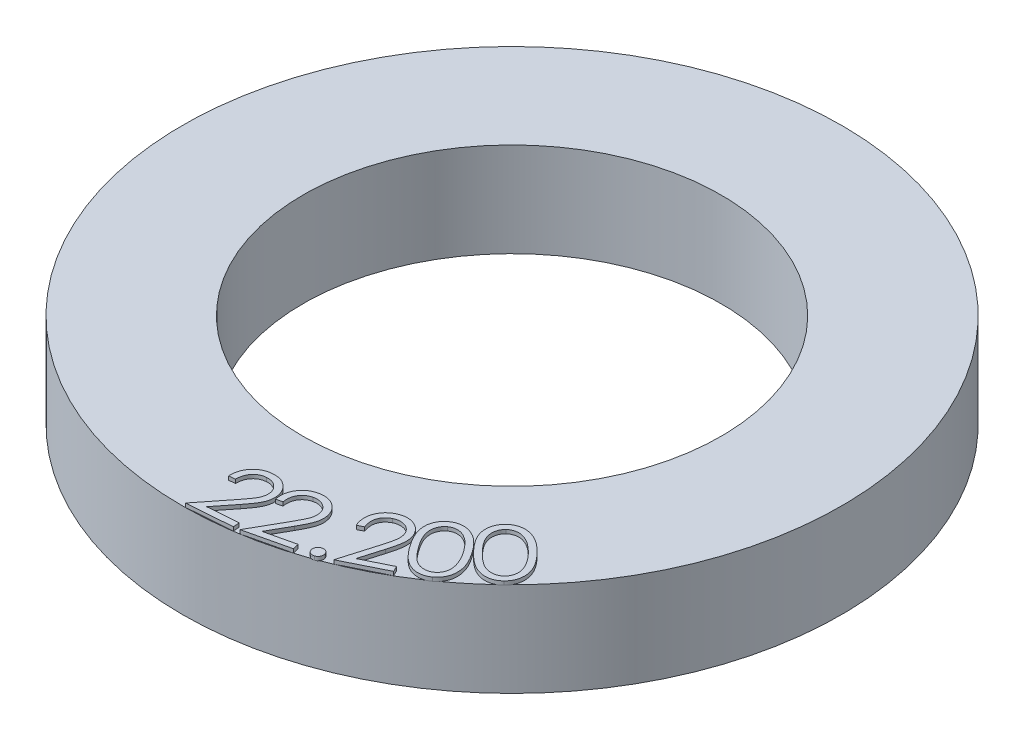
from build123d import *

# Parameters (mm, degrees)
SKETCH1_R           = 17.5
SKETCH1_R_2         = 11.1
BOSS_EXTRUDE1_DEPTH = 5
BOSS_EXTRUDE9_DEPTH = 0.2


with BuildPart() as part:
    # Sketch1 → Boss-Extrude1 (new body)
    with BuildSketch(Plane(origin=(0, 0, 0), x_dir=(1, 0, 0), z_dir=(0, 1, 0))):
        Circle(SKETCH1_R)
        Circle(SKETCH1_R_2, mode=Mode.SUBTRACT)
    extrude(amount=BOSS_EXTRUDE1_DEPTH)

    # Sketch9 → Boss-Extrude9 (add)
    # profile 1 of 6: a face of its own
    with BuildSketch(Plane(origin=(0, 5, 0), x_dir=(1, 0, 0), z_dir=(0, 1, 0))):
        with BuildLine():
            Line((0.377203526, -15.06640625), (0.043469551, -15.092347756))
            add(Edge.make_bspline(
                [(0.043469551, -15.092347756), (0.042203297, -15.050032699), (0.039723419, -14.96716131), (0.049638285, -14.844981972), (0.067688405, -14.727624407), (0.098455755, -14.61556583), (0.138504263, -14.508522308), (0.188279293, -14.405930448), (0.249943807, -14.309195828), (0.320224245, -14.217586795), (0.399116148, -14.133937543), (0.484222111, -14.059456033), (0.574336923, -13.993992114), (0.671078969, -13.940092371), (0.773224869, -13.895612995), (0.881084602, -13.861423192), (0.994390789, -13.836174987), (1.072362547, -13.828578994), (1.111979167, -13.824719551)],
                knots=[0, 0, 0, 0, 1.099165856, 2.152647473, 3.179901334, 4.180092559, 5.165857059, 6.14623908, 7.136854445, 8.141313093, 9.142222958, 10.119044223, 11.076246807, 12.030555843, 12.990566437, 13.966122304, 14.966608418, 16, 16, 16, 16], degree=3))
            add(Edge.make_bspline(
                [(1.111979167, -13.824719551), (1.151232363, -13.822614291), (1.227892409, -13.818502795), (1.341072803, -13.824300473), (1.449209712, -13.840047194), (1.552456645, -13.867170925), (1.650809554, -13.903432336), (1.744251767, -13.950064736), (1.832189716, -14.007297288), (1.914237577, -14.07371881), (1.989801801, -14.146775331), (2.056191283, -14.225750107), (2.115236363, -14.307662186), (2.163673815, -14.394967734), (2.203994369, -14.485852699), (2.23381166, -14.581483532), (2.256306856, -14.680631266), (2.263224051, -14.74868976), (2.266726763, -14.783153045)],
                knots=[0, 0, 0, 0, 1.125255338, 2.197582177, 3.23984224, 4.249678898, 5.249348258, 6.237204937, 7.234226399, 8.248247252, 9.256507582, 10.239567543, 11.199778339, 12.143800945, 13.093950023, 14.042329097, 15.008679649, 16, 16, 16, 16], degree=3))
            add(Edge.make_bspline(
                [(2.266726763, -14.783153045), (2.268653871, -14.83201524), (2.272472697, -14.928842275), (2.256591946, -15.073272294), (2.221554197, -15.213909987), (2.177756368, -15.329043673), (2.13210079, -15.422970742), (2.088829613, -15.499650514), (2.039151976, -15.583479859), (1.980752569, -15.67318269), (1.913642882, -15.76882397), (1.840613729, -15.872212721), (1.757921696, -15.980725817), (1.700055339, -16.055042687), (1.670072115, -16.093549679)],
                knots=[0, 0, 0, 0, 1.190284496, 2.358709392, 3.525773572, 4.713480732, 5.352743619, 6.06901355, 6.858115264, 7.726847504, 8.676217017, 9.704931629, 10.810819393, 12, 12, 12, 12], degree=3))
            Line((1.670072115, -16.093549679), (0.875701122, -17.094751603))
            Line((0.875701122, -17.094751603), (2.482672276, -16.971354167))
            Line((2.482672276, -16.971354167), (2.508613782, -17.307191506))
            Line((2.508613782, -17.307191506), (0.14443109, -17.488782051))
            Line((0.14443109, -17.488782051), (1.363681891, -15.949819712))
            add(Edge.make_bspline(
                [(1.363681891, -15.949819712), (1.393527022, -15.912554926), (1.450782044, -15.841066007), (1.530584566, -15.73612355), (1.602999147, -15.639675593), (1.666852925, -15.550639363), (1.722438282, -15.469396851), (1.76961629, -15.395481899), (1.809021619, -15.329602995), (1.849329165, -15.251857602), (1.888211722, -15.159145837), (1.917541309, -15.046099013), (1.933704742, -14.93175562), (1.93042781, -14.855174346), (1.928786058, -14.816806891)],
                knots=[0, 0, 0, 0, 1.323859622, 2.539697786, 3.655679983, 4.668207506, 5.577749991, 6.384956845, 7.099630202, 7.705429782, 8.812646299, 9.878423536, 10.93708365, 12, 12, 12, 12], degree=3))
            add(Edge.make_bspline(
                [(1.928786058, -14.816806891), (1.92620974, -14.792668697), (1.921140936, -14.745177743), (1.905685163, -14.675960851), (1.882668381, -14.610204079), (1.854314913, -14.54686504), (1.818130268, -14.487171166), (1.775716227, -14.430480301), (1.726271651, -14.377301953), (1.671340099, -14.327125852), (1.611934069, -14.281949704), (1.548780398, -14.24375581), (1.483443961, -14.212316408), (1.415907726, -14.186368957), (1.345139571, -14.169292508), (1.271999298, -14.157876025), (1.196114655, -14.153502913), (1.144924611, -14.156323447), (1.118990385, -14.157752404)],
                knots=[0, 0, 0, 0, 1.002985613, 1.973335034, 2.923515741, 3.878986154, 4.836651989, 5.802759845, 6.800988188, 7.833639541, 8.87511098, 9.880838076, 10.878972912, 11.86950441, 12.865345595, 13.881918786, 14.926924211, 16, 16, 16, 16], degree=3))
            add(Edge.make_bspline(
                [(1.118990385, -14.157752404), (1.091811261, -14.160540619), (1.038491161, -14.166010548), (0.960749235, -14.182373159), (0.886899306, -14.205342141), (0.817246391, -14.235736869), (0.751710741, -14.272344942), (0.690146343, -14.315288584), (0.633132276, -14.365692478), (0.580060436, -14.422065975), (0.532383632, -14.484564259), (0.490634628, -14.552362028), (0.455698611, -14.625546395), (0.426899376, -14.703718722), (0.404472482, -14.787020099), (0.388336351, -14.875402791), (0.379467781, -14.969236984), (0.377971809, -15.033435801), (0.377203526, -15.06640625)],
                knots=[0, 0, 0, 0, 1.003856858, 1.969369873, 2.914991585, 3.842326504, 4.757764574, 5.67065914, 6.596081697, 7.550367434, 8.512664105, 9.480773, 10.472199548, 11.488843046, 12.539268398, 13.639696742, 14.787824085, 16, 16, 16, 16], degree=3))
        make_face()
    # profile 2 of 6: a face of its own
    with BuildSketch(Plane(origin=(0, 5, 0), x_dir=(1, 0, 0), z_dir=(0, 1, 0))):
        with BuildLine():
            Line((2.680077799, -14.84254585), (2.355458408, -14.918267004))
            add(Edge.make_bspline(
                [(2.355458408, -14.918267004), (2.347994142, -14.876767046), (2.333387531, -14.795556953), (2.323472579, -14.673990721), (2.324976016, -14.555728299), (2.336513827, -14.440605451), (2.359783356, -14.328975701), (2.394590343, -14.221092867), (2.439601661, -14.116379831), (2.494569659, -14.015576781), (2.559832485, -13.921863348), (2.631188548, -13.834656401), (2.710921768, -13.757361702), (2.797573287, -13.688946733), (2.891342116, -13.629703088), (2.992353062, -13.580084855), (3.099856127, -13.537971321), (3.175300136, -13.518303724), (3.213631485, -13.508311075)],
                knots=[0, 0, 0, 0, 1.100238416, 2.153025381, 3.178012026, 4.183884262, 5.168591255, 6.148695239, 7.138002634, 8.140019377, 9.140121407, 10.114951831, 11.077023251, 12.032670763, 12.99234068, 13.966349905, 14.966749606, 16, 16, 16, 16], degree=3))
            add(Edge.make_bspline(
                [(3.213631485, -13.508311075), (3.251843088, -13.50036415), (3.32664053, -13.484808413), (3.438897548, -13.473770246), (3.547813259, -13.472847982), (3.653615731, -13.482442125), (3.755983303, -13.503477882), (3.854414489, -13.536291351), (3.950096274, -13.578421826), (4.040814221, -13.631584861), (4.126003653, -13.692404589), (4.204208412, -13.758970295), (4.274030899, -13.831494589), (4.335160407, -13.90960072), (4.388361962, -13.993145467), (4.432982751, -14.082231672), (4.470178835, -14.176708828), (4.487307474, -14.242643219), (4.495983248, -14.27603944)],
                knots=[0, 0, 0, 0, 1.121990491, 2.196244399, 3.238232453, 4.250969426, 5.246356061, 6.236987075, 7.230101134, 8.248200839, 9.255501669, 10.237657177, 11.19803806, 12.146105858, 13.086011545, 14.042029985, 15.008274769, 16, 16, 16, 16], degree=3))
            add(Edge.make_bspline(
                [(4.495983248, -14.27603944), (4.505415824, -14.323774993), (4.524110077, -14.41838123), (4.529985585, -14.56283772), (4.516844757, -14.706380405), (4.49162199, -14.826395359), (4.460506924, -14.925374116), (4.431085731, -15.007919873), (4.393488718, -15.097141834), (4.349829317, -15.194418504), (4.299347185, -15.299042154), (4.242538162, -15.411720311), (4.177915647, -15.531101044), (4.131979942, -15.612908193), (4.108262895, -15.655146011)],
                knots=[0, 0, 0, 0, 1.190223456, 2.358882579, 3.52524119, 4.712819824, 5.35365978, 6.065105631, 6.857984567, 7.723828008, 8.67607557, 9.702436758, 10.813745988, 12, 12, 12, 12], degree=3))
            Line((4.108262895, -15.655146011), (3.479356645, -16.761516203))
            Line((3.479356645, -16.761516203), (5.041456004, -16.394829504))
            Line((5.041456004, -16.394829504), (5.11787828, -16.721552261))
            Line((5.11787828, -16.721552261), (2.819601036, -17.260714921))
            Line((2.819601036, -17.260714921), (3.785045748, -15.56119569))
            add(Edge.make_bspline(
                [(3.785045748, -15.56119569), (3.808529371, -15.519892567), (3.8536226, -15.440582352), (3.91665988, -15.325551236), (3.973290102, -15.219474376), (4.021957514, -15.121779814), (4.064311127, -15.032979861), (4.100364837, -14.953571722), (4.128654637, -14.882434307), (4.156784414, -14.800101176), (4.179688984, -14.702577351), (4.192972915, -14.587024863), (4.189968714, -14.471889792), (4.175230987, -14.396958355), (4.167858248, -14.359472934)],
                knots=[0, 0, 0, 0, 1.322508168, 2.539478858, 3.65113322, 4.669382137, 5.577246142, 6.389686428, 7.096378664, 7.707362647, 8.810322298, 9.877140803, 10.938012216, 12, 12, 12, 12], degree=3))
            add(Edge.make_bspline(
                [(4.167858248, -14.359472934), (4.161829404, -14.336171476), (4.149935411, -14.290201239), (4.123387221, -14.224893717), (4.091995869, -14.16328915), (4.053584185, -14.106135055), (4.009399893, -14.052600205), (3.95860095, -14.003544562), (3.901957352, -13.958350343), (3.840235373, -13.917568468), (3.775029978, -13.881814057), (3.707248163, -13.853637752), (3.637912338, -13.832678602), (3.56741324, -13.817301491), (3.494890393, -13.811664684), (3.421495235, -13.811468351), (3.346244991, -13.818247864), (3.296509601, -13.82889709), (3.271123472, -13.834332709)],
                knots=[0, 0, 0, 0, 0.998805992, 1.97049261, 2.921394182, 3.866479787, 4.824835265, 5.799717433, 6.794315519, 7.830951375, 8.869177059, 9.878822869, 10.873799922, 11.875291578, 12.869368348, 13.888722291, 14.922353531, 16, 16, 16, 16], degree=3))
            add(Edge.make_bspline(
                [(3.271123472, -13.834332709), (3.244792519, -13.841064204), (3.193002937, -13.854304184), (3.119061623, -13.882705923), (3.050115946, -13.91714881), (2.986034959, -13.957311139), (2.926579811, -14.002814596), (2.87305675, -14.05555418), (2.823928987, -14.113545846), (2.780414933, -14.177443519), (2.743380272, -14.246402199), (2.712244756, -14.319205359), (2.689061885, -14.396615139), (2.673136557, -14.477873433), (2.664009273, -14.563501926), (2.662180891, -14.653056839), (2.666949138, -14.746824786), (2.675629023, -14.810109822), (2.680077799, -14.84254585)],
                knots=[0, 0, 0, 0, 1.001857296, 1.97052376, 2.915105733, 3.840812044, 4.756468097, 5.670946457, 6.606992161, 7.556283339, 8.516782409, 9.490308786, 10.47212129, 11.491627338, 12.540773751, 13.644567144, 14.792749573, 16, 16, 16, 16], degree=3))
        make_face()
    # profile 3 of 6: a face of its own
    with BuildSketch(Plane(origin=(0, 5, 0), x_dir=(1, 0, 0), z_dir=(0, 1, 0))):
        with BuildLine():
            add(Edge.make_bspline(
                [(5.812610444, -15.938128556), (5.831374417, -15.932374898), (5.868100028, -15.921113607), (5.925587729, -15.918820778), (5.982023209, -15.927326543), (6.036365652, -15.947186897), (6.086750753, -15.976062519), (6.129683552, -16.014781695), (6.164195697, -16.061839206), (6.179302393, -16.097844445), (6.187009483, -16.116213491)],
                knots=[0, 0, 0, 0, 1.018533362, 1.993514881, 2.966138152, 3.9748784, 4.989476654, 5.972026843, 6.965374611, 8, 8, 8, 8], degree=3))
            add(Edge.make_bspline(
                [(6.187009483, -16.116213491), (6.192680674, -16.134982532), (6.203852009, -16.171954526), (6.207259114, -16.229869607), (6.198423544, -16.286997519), (6.178873974, -16.341926891), (6.149719297, -16.392227049), (6.111823907, -16.435344643), (6.065578658, -16.469979456), (6.029886494, -16.484584723), (6.011729034, -16.492014773)],
                knots=[0, 0, 0, 0, 1.018247088, 2.005783202, 2.990165439, 4.010083513, 5.024396598, 5.998572224, 6.981825626, 8, 8, 8, 8], degree=3))
            add(Edge.make_bspline(
                [(6.011729034, -16.492014773), (5.992964701, -16.497770106), (5.956238387, -16.509034678), (5.898755786, -16.511303732), (5.842003107, -16.502843983), (5.787364663, -16.482393394), (5.737095106, -16.452595757), (5.694096527, -16.414271405), (5.660232144, -16.367416245), (5.645083379, -16.332037335), (5.637329996, -16.313929838)],
                knots=[0, 0, 0, 0, 1.019327242, 1.995068695, 2.968450063, 3.99358383, 5.015165017, 5.99848104, 6.975590248, 8, 8, 8, 8], degree=3))
            add(Edge.make_bspline(
                [(5.637329996, -16.313929838), (5.63125142, -16.294941947), (5.619366426, -16.257816312), (5.617673921, -16.1996281), (5.624612676, -16.142442807), (5.645777227, -16.087974496), (5.675371175, -16.038150206), (5.712952105, -15.994657098), (5.759716127, -15.961248414), (5.794765915, -15.945928316), (5.812610444, -15.938128556)],
                knots=[0, 0, 0, 0, 1.033330105, 2.02039479, 3.003248301, 4.016090021, 5.036799157, 6.01117572, 6.98745084, 8, 8, 8, 8], degree=3))
        make_face()
    # profile 4 of 6: a face of its own
    with BuildSketch(Plane(origin=(0, 5, 0), x_dir=(1, 0, 0), z_dir=(0, 1, 0))):
        with BuildLine():
            Line((6.001967488, -13.825784929), (5.702588481, -13.97442275))
            add(Edge.make_bspline(
                [(5.702588481, -13.97442275), (5.685820824, -13.935647981), (5.652971266, -13.859684236), (5.615366393, -13.743154614), (5.590497806, -13.627273302), (5.575039188, -13.512168107), (5.572189463, -13.397675061), (5.581852614, -13.28411572), (5.601054551, -13.171207906), (5.633145609, -13.060466763), (5.673495528, -12.952927229), (5.725335534, -12.852311195), (5.785096594, -12.758589391), (5.853397414, -12.671412601), (5.931763681, -12.592336106), (6.018296114, -12.519614104), (6.11423699, -12.454603032), (6.183416212, -12.418216443), (6.218614122, -12.399703199)],
                knots=[0, 0, 0, 0, 1.098216958, 2.151519521, 3.177948553, 4.176818265, 5.167798255, 6.149509108, 7.136735762, 8.141063819, 9.143385336, 10.119208589, 11.078539156, 12.030603135, 12.993316239, 13.9683821, 14.966326847, 16, 16, 16, 16], degree=3))
            add(Edge.make_bspline(
                [(6.218614122, -12.399703199), (6.254108919, -12.383194162), (6.32393023, -12.35071947), (6.43114222, -12.313475674), (6.537857316, -12.288262433), (6.643215578, -12.2728673), (6.748120394, -12.270285627), (6.852018267, -12.278626884), (6.955213384, -12.298455178), (7.056185903, -12.329531901), (7.153670355, -12.368980935), (7.245165062, -12.416808689), (7.329730409, -12.47194654), (7.408224671, -12.533336388), (7.478366063, -12.603917009), (7.543252607, -12.679970693), (7.600620697, -12.764273206), (7.632638787, -12.82472532), (7.648902584, -12.855432365)],
                knots=[0, 0, 0, 0, 1.120251964, 2.203631692, 3.242265402, 4.255679864, 5.246286426, 6.239781059, 7.234446576, 8.24830269, 9.25968307, 10.241300852, 11.19891005, 12.146674702, 13.088183727, 14.042538329, 15.005694608, 16, 16, 16, 16], degree=3))
            add(Edge.make_bspline(
                [(7.648902584, -12.855432365), (7.668992821, -12.899855098), (7.708920725, -12.988142087), (7.748067721, -13.128098782), (7.768240766, -13.271648984), (7.770631342, -13.394750405), (7.762858058, -13.498559304), (7.752092962, -13.585785611), (7.736493913, -13.68187063), (7.716013743, -13.787055879), (7.69069926, -13.901123287), (7.660545135, -14.024148371), (7.624504342, -14.155549315), (7.598518339, -14.246018432), (7.5851005, -14.292732045)],
                knots=[0, 0, 0, 0, 1.187463185, 2.359997786, 3.528509958, 4.713988962, 5.35383184, 6.065580174, 6.856257793, 7.726840367, 8.678057719, 9.704934027, 10.814945631, 12, 12, 12, 12], degree=3))
            Line((7.5851005, -14.292732045), (7.224723898, -15.518994064))
            Line((7.224723898, -15.518994064), (8.667632552, -14.80244759))
            Line((8.667632552, -14.80244759), (8.816971494, -15.103929961))
            Line((8.816971494, -15.103929961), (6.693974699, -16.157716019))
            Line((6.693974699, -16.157716019), (7.247860917, -14.275204))
            add(Edge.make_bspline(
                [(7.247860917, -14.275204), (7.261216532, -14.229408296), (7.286876156, -14.141422794), (7.323272157, -14.014573528), (7.352928105, -13.897448573), (7.379238865, -13.79101086), (7.400466112, -13.694725735), (7.416680923, -13.608691772), (7.428254495, -13.532710147), (7.436784056, -13.445777823), (7.437679595, -13.345309727), (7.423574568, -13.229573332), (7.394631036, -13.117883998), (7.363161271, -13.048093644), (7.347420212, -13.013184769)],
                knots=[0, 0, 0, 0, 1.323043671, 2.541912292, 3.659661485, 4.673647795, 5.582680748, 6.39374756, 7.101410763, 7.71347622, 8.815383168, 9.879822486, 10.939495118, 12, 12, 12, 12], degree=3))
            add(Edge.make_bspline(
                [(7.347420212, -13.013184769), (7.336199736, -12.991870827), (7.313943969, -12.94959471), (7.27280693, -12.89181288), (7.227957876, -12.838314629), (7.176854253, -12.791398988), (7.121438056, -12.749037476), (7.060750134, -12.71243175), (6.995033612, -12.681704385), (6.925468021, -12.655795048), (6.85337338, -12.636552867), (6.780689458, -12.62340517), (6.708063405, -12.618801324), (6.635686798, -12.620547507), (6.563642767, -12.630808967), (6.491726636, -12.647573982), (6.419941269, -12.672258366), (6.373387767, -12.693761037), (6.349723898, -12.704691179)],
                knots=[0, 0, 0, 0, 0.994758845, 1.973100073, 2.925721505, 3.875988117, 4.834471289, 5.80548545, 6.799540207, 7.829750797, 8.870374877, 9.880638117, 10.878114759, 11.873717852, 12.868476697, 13.880909124, 14.922833172, 16, 16, 16, 16], degree=3))
            add(Edge.make_bspline(
                [(6.349723898, -12.704691179), (6.325650167, -12.717362623), (6.278165227, -12.742356785), (6.212118308, -12.786429715), (6.153131579, -12.836220645), (6.098864702, -12.889172981), (6.053262642, -12.948802926), (6.011531189, -13.011471236), (5.977611366, -13.079731547), (5.949408591, -13.151936052), (5.92839382, -13.227779199), (5.914822451, -13.306460902), (5.910509511, -13.387530291), (5.912202467, -13.470857467), (5.923178633, -13.556459032), (5.94169448, -13.644521266), (5.967463926, -13.735074122), (5.990292997, -13.795092375), (6.001967488, -13.825784929)],
                knots=[0, 0, 0, 0, 0.999474696, 1.971443358, 2.910637607, 3.833827542, 4.751406304, 5.663865081, 6.597307257, 7.546386594, 8.509165209, 9.48492176, 10.474530171, 11.488406048, 12.544202824, 13.640856743, 14.793564798, 16, 16, 16, 16], degree=3))
        make_face()
    # profile 5 of 6: a face of its own
    with BuildSketch(Plane(origin=(0, 5, 0), x_dir=(1, 0, 0), z_dir=(0, 1, 0))):
        with BuildLine():
            add(Edge.make_bspline(
                [(8.094622628, -13.519240223), (8.062802559, -13.473618044), (8.000905639, -13.384873031), (7.915172489, -13.252508419), (7.839826708, -13.124911808), (7.772418464, -13.003590397), (7.715531182, -12.886947474), (7.667790368, -12.775573225), (7.628608309, -12.669765668), (7.599775725, -12.568374636), (7.57829551, -12.470964938), (7.564758618, -12.376238395), (7.555557095, -12.284294604), (7.554709495, -12.194779161), (7.558280296, -12.107556209), (7.56976583, -12.022720596), (7.587145911, -11.940382527), (7.611262051, -11.861045683), (7.640449512, -11.784480464), (7.675936321, -11.711756768), (7.714835306, -11.641852914), (7.759909289, -11.576363682), (7.810818614, -11.515563075), (7.86566587, -11.457507344), (7.925820181, -11.403394691), (7.96954674, -11.3711224), (7.991557724, -11.354877242)],
                knots=[0, 0, 0, 0, 1.642969674, 3.19593159, 4.656913794, 6.01942512, 7.294540572, 8.488352722, 9.597764224, 10.624727227, 11.599650019, 12.541783054, 13.449916964, 14.326759598, 15.183784796, 16.026369362, 16.852301942, 17.666934368, 18.473335003, 19.269954597, 20.055155662, 20.834508302, 21.614105503, 22.395381983, 23.192270741, 24, 24, 24, 24], degree=3))
            add(Edge.make_bspline(
                [(7.991557724, -11.354877242), (8.014728533, -11.339369003), (8.060599513, -11.308667524), (8.132399536, -11.268508388), (8.206244921, -11.234711547), (8.282223955, -11.207274971), (8.360094953, -11.18622085), (8.439854178, -11.171628727), (8.521136268, -11.162312696), (8.604110397, -11.159724321), (8.688578721, -11.162812956), (8.773819287, -11.174536389), (8.859848673, -11.192041023), (8.946298698, -11.216384108), (9.032693031, -11.249590455), (9.120586474, -11.287478045), (9.207995817, -11.334602958), (9.297025092, -11.387017274), (9.386746062, -11.44853229), (9.47668636, -11.520010056), (9.567394573, -11.601350717), (9.659297285, -11.691511762), (9.750755999, -11.792501066), (9.844512668, -11.901837519), (9.938055541, -12.021739437), (9.999130712, -12.106053576), (10.030419903, -12.149248236)],
                knots=[0, 0, 0, 0, 0.81737431, 1.618146333, 2.409359726, 3.196287572, 3.98428899, 4.771962527, 5.571913005, 6.381057778, 7.204158073, 8.047410857, 8.900877879, 9.777286907, 10.677253619, 11.613163999, 12.581895576, 13.586798653, 14.641794363, 15.768831792, 16.953190825, 18.213177769, 19.542243662, 20.947154321, 22.436008085, 24, 24, 24, 24], degree=3))
            add(Edge.make_bspline(
                [(10.030419903, -12.149248236), (10.060629559, -12.192752207), (10.119610721, -12.277689116), (10.200846542, -12.405103815), (10.273255924, -12.528865303), (10.337509449, -12.648219026), (10.391181621, -12.764540131), (10.43820567, -12.875909357), (10.475554519, -12.983869211), (10.50344957, -13.088309499), (10.524903819, -13.188904255), (10.538885623, -13.286836764), (10.546725682, -13.381904246), (10.548159793, -13.474420371), (10.543613126, -13.564233062), (10.531370439, -13.651605278), (10.513443822, -13.736309086), (10.488669914, -13.817775923), (10.458612044, -13.895915034), (10.422515108, -13.970199551), (10.382414939, -14.041346734), (10.335121159, -14.10739704), (10.284634864, -14.170670648), (10.227738255, -14.228915781), (10.166760539, -14.284258646), (10.122326211, -14.317244424), (10.099830961, -14.333943749)],
                knots=[0, 0, 0, 0, 1.554546396, 3.035087675, 4.433995603, 5.762808296, 7.011883954, 8.192851325, 9.310096466, 10.361795966, 11.364123238, 12.327475774, 13.263475298, 14.162233118, 15.041618427, 15.900208728, 16.749208619, 17.580395342, 18.396988438, 19.203929376, 20.002899753, 20.790808823, 21.585763951, 22.37656444, 23.178122201, 24, 24, 24, 24], degree=3))
            add(Edge.make_bspline(
                [(10.099830961, -14.333943749), (10.077145847, -14.349248799), (10.032078172, -14.379654774), (9.961226292, -14.41874203), (9.888830277, -14.451849879), (9.814590203, -14.47895069), (9.738195859, -14.498824708), (9.660247994, -14.513948211), (9.580492187, -14.52198494), (9.499406039, -14.52527875), (9.417145054, -14.520571171), (9.334005043, -14.510527935), (9.250744084, -14.491700989), (9.166953442, -14.467370492), (9.082999509, -14.435274057), (8.998560513, -14.396718689), (8.913206968, -14.351906005), (8.827985738, -14.298567689), (8.7409939, -14.237532695), (8.653670568, -14.165241162), (8.563416086, -14.08401014), (8.472884445, -13.99107976), (8.379836956, -13.888342291), (8.285786421, -13.774791097), (8.189344545, -13.65134699), (8.126795343, -13.564110867), (8.094622628, -13.519240223)],
                knots=[0, 0, 0, 0, 0.809272868, 1.607752371, 2.390541581, 3.162600615, 3.942452978, 4.723530369, 5.509215026, 6.311725545, 7.121736464, 7.944163862, 8.786349334, 9.643974587, 10.523613564, 11.442588803, 12.389010581, 13.373290706, 14.414956715, 15.530440954, 16.724797808, 18.00575213, 19.366615439, 20.824635093, 22.366724005, 24, 24, 24, 24], degree=3))
        make_face()
        with BuildLine():
            add(Edge.make_bspline(
                [(8.365956762, -13.335546313), (8.393510609, -13.374297237), (8.446854462, -13.449318471), (8.528670384, -13.555366739), (8.60742359, -13.652413873), (8.683255254, -13.740695546), (8.756871397, -13.819358639), (8.828009376, -13.888883065), (8.897135344, -13.948671365), (8.983061364, -14.016109508), (9.090682186, -14.083183592), (9.220880812, -14.144186183), (9.351696053, -14.182240709), (9.481053903, -14.197814082), (9.605574298, -14.192509381), (9.722863886, -14.171389658), (9.831778948, -14.131421788), (9.89596962, -14.090684827), (9.928056121, -14.070321954)],
                knots=[0, 0, 0, 0, 1.1827903, 2.289865089, 3.331380946, 4.291831117, 5.184420272, 6.010858608, 6.765099688, 7.457072956, 8.726634343, 9.910338833, 11.023625153, 12.101035577, 13.136741818, 14.112849547, 15.056684504, 16, 16, 16, 16], degree=3))
            add(Edge.make_bspline(
                [(9.928056121, -14.070321954), (9.958199072, -14.04678767), (10.018343826, -13.999829305), (10.092226445, -13.911003214), (10.151977219, -13.809676547), (10.188798626, -13.71588697), (10.21025699, -13.63528289), (10.221226632, -13.571686685), (10.227787531, -13.505846005), (10.228373195, -13.438049047), (10.223135367, -13.368026291), (10.213304743, -13.296150287), (10.19866591, -13.22182417), (10.184779219, -13.17233303), (10.17765548, -13.14694455)],
                knots=[0, 0, 0, 0, 1.341040386, 2.675801171, 4.031107013, 5.461979847, 6.201214193, 6.960221384, 7.727760243, 8.524631316, 9.339919908, 10.193817199, 11.073445551, 12, 12, 12, 12], degree=3))
            add(Edge.make_bspline(
                [(10.17765548, -13.14694455), (10.167938882, -13.115049884), (10.148263929, -13.050466983), (10.111960299, -12.953900562), (10.069762738, -12.855689717), (10.021636612, -12.755637251), (9.966504562, -12.654693832), (9.906049555, -12.551974848), (9.839582479, -12.447706175), (9.791796167, -12.37859734), (9.76749923, -12.343458973)],
                knots=[0, 0, 0, 0, 0.882770903, 1.78750597, 2.7301835, 3.712848721, 4.726406589, 5.775105665, 6.868753104, 8, 8, 8, 8], degree=3))
            add(Edge.make_bspline(
                [(9.76749923, -12.343458973), (9.742469511, -12.308714131), (9.693584027, -12.240854065), (9.618463937, -12.144094543), (9.544192078, -12.054230221), (9.470562895, -11.971190569), (9.397045064, -11.895188191), (9.32314986, -11.826925813), (9.251403872, -11.763699841), (9.178695529, -11.709212967), (9.107364869, -11.660697413), (9.036821099, -11.61850894), (8.967728429, -11.581484804), (8.89867186, -11.552421598), (8.831225963, -11.527997279), (8.764360431, -11.510428798), (8.698428352, -11.498992319), (8.613566434, -11.493001321), (8.511380475, -11.495703996), (8.395399698, -11.518634592), (8.287095086, -11.557097897), (8.223682656, -11.597608066), (8.192078557, -11.617797915)],
                knots=[0, 0, 0, 0, 1.331638351, 2.600819572, 3.808731856, 4.956753649, 6.0515447, 7.095453716, 8.084829487, 9.023883899, 9.918928688, 10.766532722, 11.5792985, 12.354234065, 13.094443839, 13.808425764, 14.501457742, 15.172059793, 16.451996366, 17.66645092, 18.8369833, 20, 20, 20, 20], degree=3))
            add(Edge.make_bspline(
                [(8.192078557, -11.617797915), (8.162180822, -11.641349129), (8.102244695, -11.688562358), (8.028366359, -11.777948466), (7.968925161, -11.880744507), (7.931685436, -11.975580094), (7.909095681, -12.056724502), (7.898140233, -12.120876356), (7.891858749, -12.186959221), (7.890310606, -12.255177544), (7.894814366, -12.3252212), (7.904067545, -12.397326462), (7.91815239, -12.471290358), (7.937014839, -12.548086786), (7.96374743, -12.62826749), (7.997367428, -12.713487472), (8.038833915, -12.804161775), (8.089333614, -12.899597728), (8.146737354, -13.001133645), (8.211859923, -13.108450678), (8.285815521, -13.220565596), (8.338673709, -13.296402609), (8.365956762, -13.335546313)],
                knots=[0, 0, 0, 0, 1.180606091, 2.366766537, 3.578074944, 4.859878886, 5.522639199, 6.193986847, 6.88011338, 7.585064265, 8.312970028, 9.060096195, 9.843880725, 10.652758785, 11.516709204, 12.469302462, 13.499998018, 14.614729803, 15.825100775, 17.126058077, 18.516598594, 20, 20, 20, 20], degree=3))
        make_face(mode=Mode.SUBTRACT)
    # profile 6 of 6: a face of its own
    with BuildSketch(Plane(origin=(0, 5, 0), x_dir=(1, 0, 0), z_dir=(0, 1, 0))):
        with BuildLine():
            add(Edge.make_bspline(
                [(10.061528562, -12.10955222), (10.022956902, -12.068877282), (9.948043998, -11.989879446), (9.843004253, -11.871191764), (9.746856726, -11.757152028), (9.662558794, -11.645801129), (9.587265593, -11.538869256), (9.523014434, -11.435213056), (9.467760847, -11.335853691), (9.423120937, -11.239404772), (9.387161115, -11.145589547), (9.358439609, -11.053481538), (9.335685504, -10.96320001), (9.320265408, -10.874124207), (9.310912512, -10.786766665), (9.308712669, -10.700467974), (9.313761542, -10.61585785), (9.324855221, -10.532846238), (9.342571358, -10.452301381), (9.365447521, -10.37404815), (9.395206402, -10.299293261), (9.429624987, -10.226848525), (9.470387016, -10.157948288), (9.51591285, -10.091366706), (9.568349735, -10.028763459), (9.606703214, -9.989578446), (9.626131928, -9.969728502)],
                knots=[0, 0, 0, 0, 1.643143098, 3.191270976, 4.645664262, 6.014553529, 7.284140096, 8.478046464, 9.588014013, 10.61488382, 11.590779053, 12.531207317, 13.441789177, 14.318091217, 15.179101305, 16.015191765, 16.845564482, 17.661395641, 18.467677819, 19.261049258, 20.048571613, 20.823839802, 21.609930406, 22.392909899, 23.185896688, 24, 24, 24, 24], degree=3))
            add(Edge.make_bspline(
                [(9.626131928, -9.969728502), (9.646645091, -9.95069727), (9.687318886, -9.912961868), (9.752951978, -9.86262558), (9.82097751, -9.817156486), (9.892700351, -9.779015734), (9.966623737, -9.745702257), (10.043514762, -9.718255129), (10.123183777, -9.696568041), (10.20571016, -9.68103803), (10.290338148, -9.672191802), (10.376851129, -9.668875627), (10.464943764, -9.674490451), (10.554730722, -9.68541183), (10.646285721, -9.703999117), (10.739509478, -9.729242319), (10.834274843, -9.761744286), (10.930937146, -9.801087051), (11.029460742, -9.849217028), (11.13026139, -9.90588491), (11.233052994, -9.972445027), (11.338150651, -10.048209415), (11.4454711, -10.133940855), (11.554567784, -10.229792228), (11.66690382, -10.33373637), (11.740312315, -10.408325038), (11.777874716, -10.446491322)],
                knots=[0, 0, 0, 0, 0.814307392, 1.614620432, 2.405388273, 3.193927934, 3.97672154, 4.764468093, 5.568360162, 6.378448907, 7.206542137, 8.043948668, 8.895854568, 9.773619782, 10.675734413, 11.613311544, 12.583794371, 13.590896081, 14.649966002, 15.774206342, 16.955777189, 18.213503254, 19.545065278, 20.953335129, 22.441051684, 24, 24, 24, 24], degree=3))
            add(Edge.make_bspline(
                [(11.777874716, -10.446491322), (11.814854184, -10.485255248), (11.887044241, -10.560928863), (11.987574534, -10.675759496), (12.079295527, -10.787542626), (12.161694512, -10.896673681), (12.23353433, -11.004058588), (12.297534335, -11.10782118), (12.35070381, -11.20969791), (12.395436672, -11.308899574), (12.430866619, -11.406229864), (12.460879856, -11.501034296), (12.483379386, -11.594506766), (12.498899769, -11.686339274), (12.507460043, -11.776558786), (12.508968567, -11.865183233), (12.503213493, -11.952124966), (12.491394927, -12.037228558), (12.473097417, -12.119669422), (12.449411404, -12.199534266), (12.418928204, -12.275666565), (12.384035539, -12.349408099), (12.342167974, -12.419239764), (12.296135004, -12.487072917), (12.243421183, -12.551026654), (12.204245084, -12.590356211), (12.184525357, -12.610153181)],
                knots=[0, 0, 0, 0, 1.560920867, 3.047176545, 4.445805626, 5.773746473, 7.029772118, 8.209369219, 9.324227381, 10.375918751, 11.377815375, 12.340623291, 13.272194005, 14.176790602, 15.052286813, 15.910448986, 16.756638747, 17.588735874, 18.411585632, 19.215188949, 20.013145761, 20.798980117, 21.589668162, 22.383020387, 23.186075276, 24, 24, 24, 24], degree=3))
            add(Edge.make_bspline(
                [(12.184525357, -12.610153181), (12.16424862, -12.628954402), (12.124046156, -12.666231375), (12.059224592, -12.715701109), (11.992305933, -12.76050639), (11.922365456, -12.798903796), (11.849611869, -12.831325824), (11.774360209, -12.858062908), (11.696280994, -12.878994313), (11.615756722, -12.894783135), (11.532904199, -12.902798821), (11.448531042, -12.905134253), (11.36269871, -12.900118518), (11.275611133, -12.887862414), (11.186983445, -12.869740367), (11.096865638, -12.844171226), (11.005431965, -12.811821524), (10.911644662, -12.773094239), (10.81603972, -12.725093808), (10.717752152, -12.667036278), (10.615902013, -12.59978748), (10.511364422, -12.521162265), (10.402950549, -12.433133181), (10.291585958, -12.334444112), (10.176237024, -12.226733802), (10.100490943, -12.149354631), (10.061528562, -12.10955222)],
                knots=[0, 0, 0, 0, 0.811064481, 1.60808856, 2.389888403, 3.172620267, 3.946285432, 4.725040954, 5.513640096, 6.316661342, 7.130129069, 7.953396753, 8.791500303, 9.649899588, 10.53226685, 11.444204777, 12.396439187, 13.377193406, 14.420034322, 15.532790691, 16.725465982, 17.999767269, 19.369752981, 20.822718841, 22.365665447, 24, 24, 24, 24], degree=3))
        make_face()
        with BuildLine():
            add(Edge.make_bspline(
                [(10.304116703, -11.884492124), (10.337578269, -11.918574154), (10.402540546, -11.984741), (10.500104054, -12.077699958), (10.593067011, -12.162957402), (10.682719911, -12.238661617), (10.768464434, -12.305349323), (10.849584809, -12.364159763), (10.927584923, -12.413096761), (11.001701443, -12.454772772), (11.07418007, -12.487466292), (11.144334876, -12.516073575), (11.213934525, -12.538566035), (11.282589858, -12.555420101), (11.350311854, -12.566903194), (11.41715019, -12.572295009), (11.483263045, -12.573321261), (11.568750426, -12.566641613), (11.670517579, -12.54720082), (11.783580906, -12.506905605), (11.886149609, -12.450915311), (11.943927533, -12.400472609), (11.972786575, -12.37527738)],
                knots=[0, 0, 0, 0, 1.473957898, 2.861541556, 4.158429599, 5.366384119, 6.48165494, 7.510449078, 8.456966946, 9.322163817, 10.132208232, 10.909042953, 11.659478826, 12.387214262, 13.089187375, 13.776821919, 14.454856839, 15.127538109, 16.420448759, 17.638738311, 18.820591935, 20, 20, 20, 20], degree=3))
            add(Edge.make_bspline(
                [(11.972786575, -12.37527738), (11.999096913, -12.347144569), (12.051476146, -12.291137113), (12.111356623, -12.191364249), (12.15518686, -12.081272391), (12.177418612, -11.982136745), (12.186980934, -11.898714603), (12.188238906, -11.833712734), (12.183968496, -11.767351683), (12.174006317, -11.699854924), (12.158528791, -11.630950783), (12.137058338, -11.560904501), (12.111550388, -11.488878351), (12.089791002, -11.44169194), (12.078655966, -11.417545008)],
                knots=[0, 0, 0, 0, 1.340944698, 2.669583919, 4.030928969, 5.461188359, 6.19962706, 6.958188698, 7.726289627, 8.517420774, 9.336470106, 10.187844869, 11.072657056, 12, 12, 12, 12], degree=3))
            add(Edge.make_bspline(
                [(12.078655966, -11.417545008), (12.063987821, -11.387250039), (12.034271656, -11.325875523), (11.983464173, -11.23492443), (11.925602706, -11.144183163), (11.862651218, -11.051783909), (11.792167981, -10.959745433), (11.716675467, -10.866265116), (11.634371449, -10.772887308), (11.576158741, -10.711789779), (11.546504524, -10.680666002)],
                knots=[0, 0, 0, 0, 0.884558049, 1.79202434, 2.736150632, 3.71244019, 4.72966929, 5.78206634, 6.87015931, 8, 8, 8, 8], degree=3))
            add(Edge.make_bspline(
                [(11.546504524, -10.680666002), (11.516301384, -10.650102624), (11.457161501, -10.590257369), (11.367546578, -10.505677176), (11.279867397, -10.427540032), (11.193607132, -10.35629109), (11.10797441, -10.292846712), (11.024755152, -10.235143983), (10.943159202, -10.184037211), (10.862523381, -10.140895389), (10.783992203, -10.103457249), (10.707158132, -10.072406083), (10.632416474, -10.047329921), (10.559769283, -10.027135588), (10.488709433, -10.013658365), (10.419504972, -10.006866602), (10.352163725, -10.004956096), (10.266745298, -10.012015905), (10.165243051, -10.030256677), (10.053220513, -10.071098865), (9.951222655, -10.125903849), (9.89428322, -10.176093731), (9.865915582, -10.201098694)],
                knots=[0, 0, 0, 0, 1.326591129, 2.597559181, 3.803812624, 4.952220953, 6.050454968, 7.093242857, 8.07839134, 9.021111463, 9.915189371, 10.763364664, 11.577972641, 12.348162485, 13.089731918, 13.807721709, 14.493365527, 15.166324271, 16.451327591, 17.663329693, 18.835853919, 20, 20, 20, 20], degree=3))
            add(Edge.make_bspline(
                [(9.865915582, -10.201098694), (9.839602185, -10.229223864), (9.787080212, -10.285362167), (9.727011752, -10.385763893), (9.684471656, -10.497426589), (9.661850945, -10.597731936), (9.65250305, -10.682110796), (9.65111291, -10.747808025), (9.655590871, -10.814344744), (9.664646974, -10.88234401), (9.679586891, -10.951369214), (9.699237993, -11.021928223), (9.724553286, -11.09336078), (9.755832937, -11.166465722), (9.794229351, -11.242469839), (9.841254557, -11.321957006), (9.897038472, -11.40550307), (9.961236995, -11.493358688), (10.033850008, -11.585802517), (10.116607022, -11.681586658), (10.206493435, -11.782641277), (10.270939053, -11.849877715), (10.304116703, -11.884492124)],
                knots=[0, 0, 0, 0, 1.185970551, 2.367216757, 3.582004018, 4.861034475, 5.528469342, 6.19936335, 6.885891938, 7.584587042, 8.314486342, 9.063449579, 9.843573315, 10.65137712, 11.515794273, 12.469475821, 13.499641158, 14.614767356, 15.826768159, 17.126133982, 18.52048713, 20, 20, 20, 20], degree=3))
        make_face(mode=Mode.SUBTRACT)
    extrude(amount=BOSS_EXTRUDE9_DEPTH)


solid = part.part
